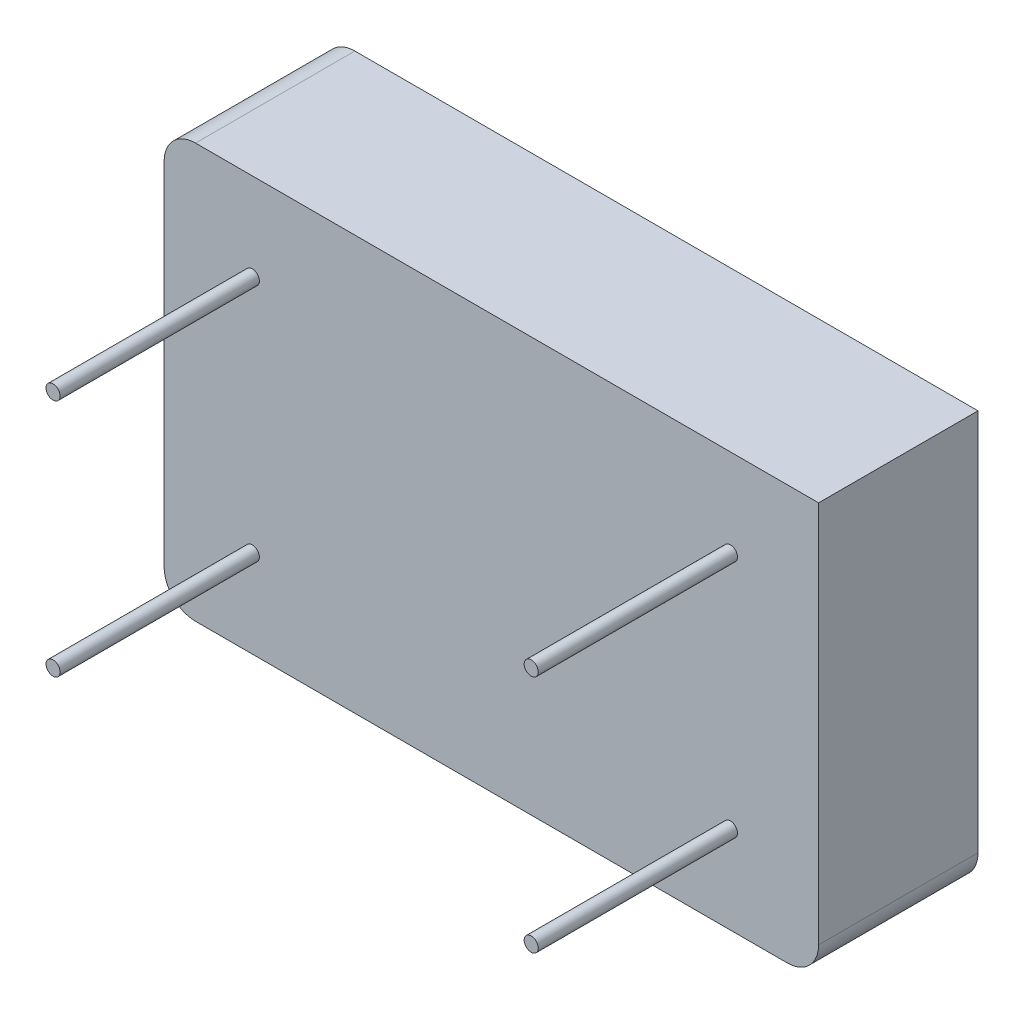
from build123d import *

# Parameters (mm, degrees)
SKETCH1_W           = 20.86
SKETCH1_H           = 13.2
BOSS_EXTRUDE1_DEPTH = 5.08
SKETCH2_R           = 0.225
BOSS_EXTRUDE2_DEPTH = 6.35
FILLET1_R           = 1


with BuildPart() as part:
    # Sketch1 → Boss-Extrude1 (new body)
    with BuildSketch(Plane.XY):
        with Locations((10.43, 6.6)):
            Rectangle(SKETCH1_W, SKETCH1_H)
    extrude(amount=BOSS_EXTRUDE1_DEPTH)

    # Sketch2 → Boss-Extrude2 (add)
    with BuildSketch(Plane.XY.offset(5.08)):
        with Locations(Location((2.81, 10.41, 0), (0, 0, 180))):
            Circle(SKETCH2_R)
        with Locations(Location((18.05, 10.41, 0), (0, 0, 180))):
            Circle(SKETCH2_R)
        with Locations(Location((18.05, 2.79, 0), (0, 0, 180))):
            Circle(SKETCH2_R)
        with Locations(Location((2.81, 2.79, 0), (0, 0, 180))):
            Circle(SKETCH2_R)
    extrude(amount=BOSS_EXTRUDE2_DEPTH)

    # Fillet1
    fillet1_edges = [part.edges().sort_by_distance(p)[0] for p in [
        (0, 13.2, 2.54),
        (20.86, 0, 2.54),
        (0, 0, 2.54),
    ]]
    fillet(fillet1_edges, radius=FILLET1_R)


solid = part.part
